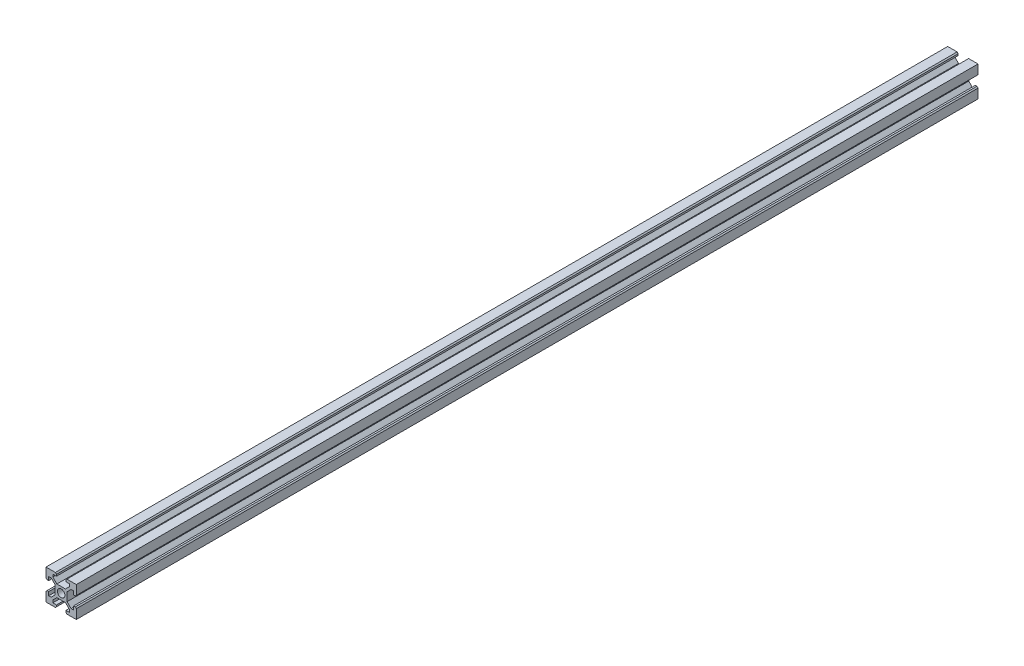
from build123d import *

# Parameters (mm, degrees)
SKETCH1_R           = 2.5
BOSS_EXTRUDE1_DEPTH = 297.5


with BuildPart() as part:
    # Sketch1 → Boss-Extrude1 (new, symmetric)
    with BuildSketch(Plane.XY):
        Polygon((3.9, -2.839339828), (6.560660172, -5.5), (8.200660172, -5.5), (8.200660172, -3.1), (9.3, -3.1), (10, -3.8), (10, -10), (3.8, -10), (3.1, -9.3), (3.1, -8.200660172), (5.5, -8.200660172), (5.5, -6.560660172), (2.839339828, -3.9), (-2.839339828, -3.9), (-5.5, -6.560660172), (-5.5, -8.200660172), (-3.1, -8.200660172), (-3.1, -9.3), (-3.8, -10), (-10, -10), (-10, -3.8), (-9.3, -3.1), (-8.200660172, -3.1), (-8.200660172, -5.5), (-6.560660172, -5.5), (-3.9, -2.839339828), (-3.9, 2.839339828), (-6.560660172, 5.5), (-8.200660172, 5.5), (-8.200660172, 3.1), (-9.3, 3.1), (-10, 3.8), (-10, 10), (-3.8, 10), (-3.1, 9.3), (-3.1, 8.200660172), (-5.5, 8.200660172), (-5.5, 6.560660172), (-2.839339828, 3.9), (2.839339828, 3.9), (5.5, 6.560660172), (5.5, 8.200660172), (3.1, 8.200660172), (3.1, 9.3), (3.8, 10), (10, 10), (10, 3.8), (9.3, 3.1), (8.200660172, 3.1), (8.200660172, 5.5), (6.560660172, 5.5), (3.9, 2.839339828), align=None)
        Circle(SKETCH1_R, mode=Mode.SUBTRACT)
    extrude(amount=BOSS_EXTRUDE1_DEPTH, both=True)


solid = part.part
